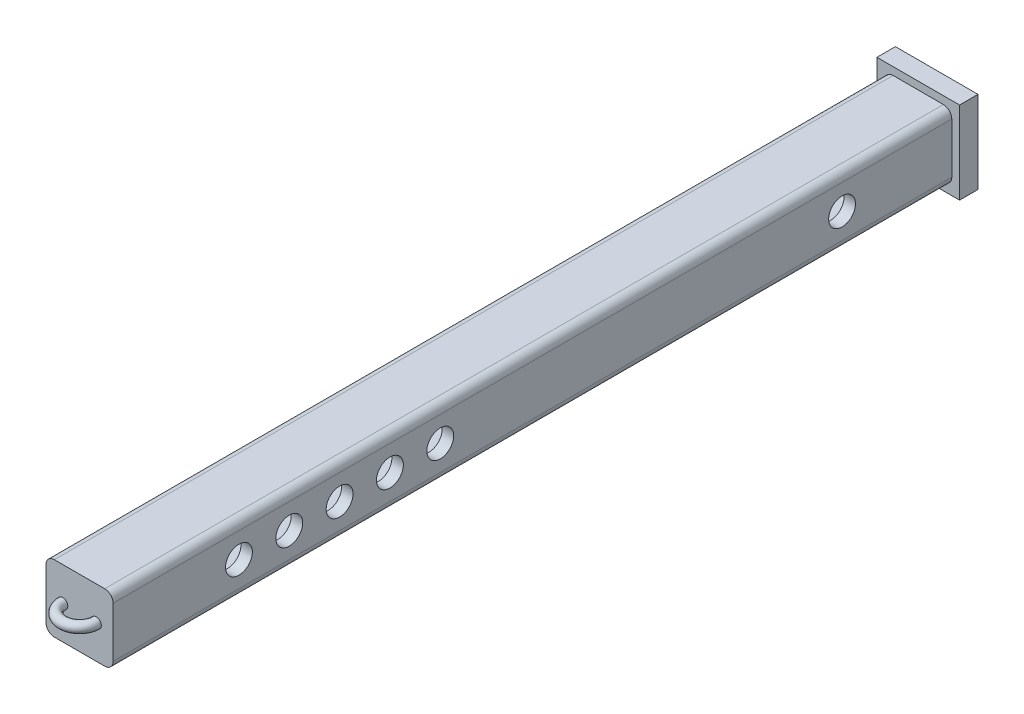
from build123d import *

# Parameters (mm, degrees)
SKETCH1_W           = 40
SKETCH1_H           = 40
BOSS_EXTRUDE1_DEPTH = 500
SKETCH2_R           = 3
FILLET1_R           = 5
SKETCH4_W           = 26.319455472
SKETCH4_H           = 27.036606846
CUT_EXTRUDE1_DEPTH  = 484
SKETCH5_W           = 49.254498594
SKETCH5_H           = 49.142556558
BOSS_EXTRUDE3_DEPTH = 11
SKETCH6_R           = 8
CUT_EXTRUDE2_DEPTH  = 149


with BuildPart() as part:
    # Sketch1 → Boss-Extrude1 (new body)
    with BuildSketch(Plane.XY):
        Rectangle(SKETCH1_W, SKETCH1_H)
    extrude(amount=BOSS_EXTRUDE1_DEPTH)

    # Sketch2 → Revolve1 (revolve)
    with BuildSketch(Plane.XY.offset(500), mode=Mode.PRIVATE) as revolve1_sk:
        with Locations((-10, 0)):
            Circle(SKETCH2_R)
    revolve(revolve1_sk.sketch.rotate(Axis((0, 23.495779736, 500), (0, -1, 0)), 270), axis=Axis((0, 23.495779736, 500), (0, -1, 0)))

    # Fillet1
    fillet1_edges = [part.edges().sort_by_distance(p)[0] for p in [
        (20, -20, 250),
        (-20, -20, 250),
        (-20, 20, 250),
        (20, 20, 250),
    ]]
    fillet(fillet1_edges, radius=FILLET1_R)

    # Sketch4 → Cut-Extrude1 (cut)
    with BuildSketch(Plane(origin=(0, 0, 0), x_dir=(-1, 0, 0), z_dir=(0, 0, -1))):
        Rectangle(SKETCH4_W, SKETCH4_H)
    extrude(amount=-CUT_EXTRUDE1_DEPTH, mode=Mode.SUBTRACT)

    # Sketch5 → Boss-Extrude3 (add)
    with BuildSketch(Plane(origin=(0, 0, 0), x_dir=(-1, 0, 0), z_dir=(0, 0, -1))):
        Rectangle(SKETCH5_W, SKETCH5_H)
    extrude(amount=BOSS_EXTRUDE3_DEPTH)

    # Sketch6 → Cut-Extrude2 (cut)
    with BuildSketch(Plane(origin=(20, 0, 0), x_dir=(0, 0, -1), z_dir=(1, 0, 0))):
        with Locations((-65.399193922, 0)):
            Circle(SKETCH6_R)
        with Locations((-304.968679319, 0)):
            Circle(SKETCH6_R)
        with Locations((-334.968679319, 0)):
            Circle(SKETCH6_R)
        with Locations((-364.968679319, 0)):
            Circle(SKETCH6_R)
        with Locations((-394.968679319, 0)):
            Circle(SKETCH6_R)
        with Locations((-424.968679319, 0)):
            Circle(SKETCH6_R)
    extrude(amount=-CUT_EXTRUDE2_DEPTH, mode=Mode.SUBTRACT)


solid = part.part
